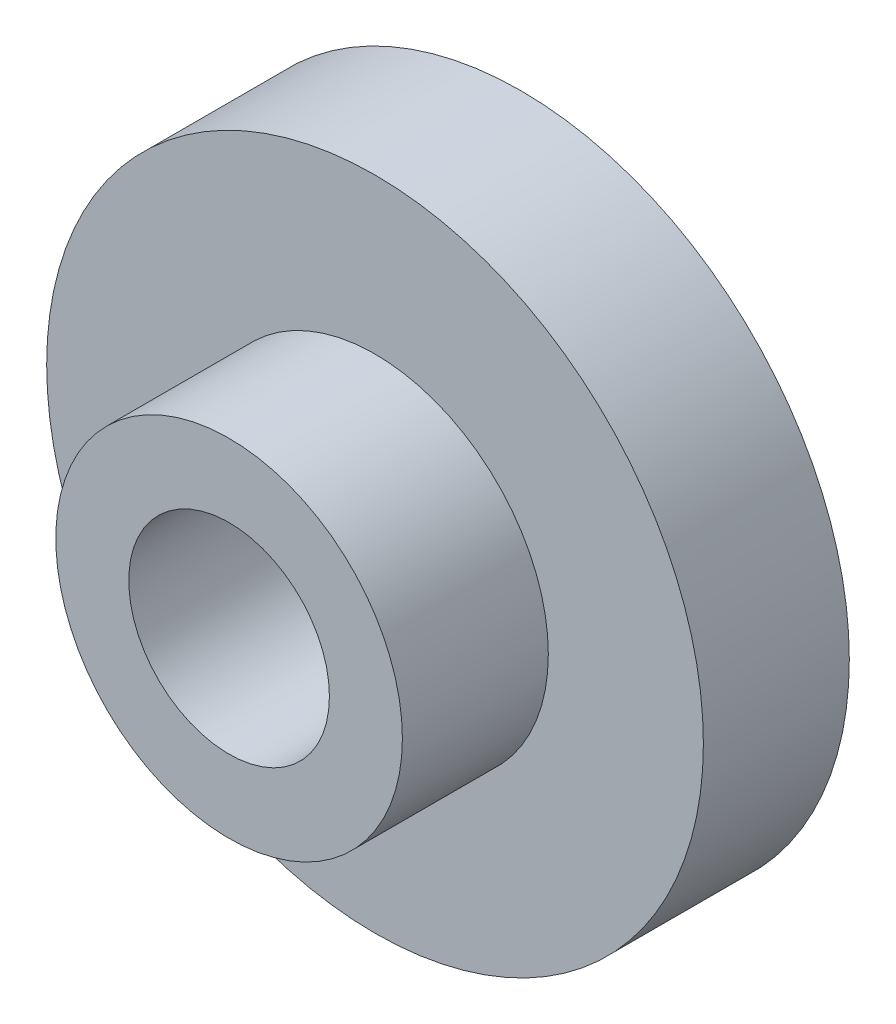
from build123d import *

# Parameters (mm, degrees)
SKETCH3_R           = 2.375
SKETCH3_R_2         = 1.375
BOSS_EXTRUDE1_DEPTH = 4
SKETCH3_3_R         = 4.5
SKETCH3_3_R_2       = 2.375
BOSS_EXTRUDE2_DEPTH = 2


with BuildPart() as part:
    # Sketch3 → Boss-Extrude1 (new body)
    with BuildSketch(Plane.XY):
        Circle(SKETCH3_R)
        Circle(SKETCH3_R_2, mode=Mode.SUBTRACT)
    extrude(amount=BOSS_EXTRUDE1_DEPTH)

    # Sketch3<3> → Boss-Extrude2 (add)
    with BuildSketch(Plane.XY):
        Circle(SKETCH3_3_R)
        Circle(SKETCH3_3_R_2, mode=Mode.SUBTRACT)
    extrude(amount=BOSS_EXTRUDE2_DEPTH)


solid = part.part
